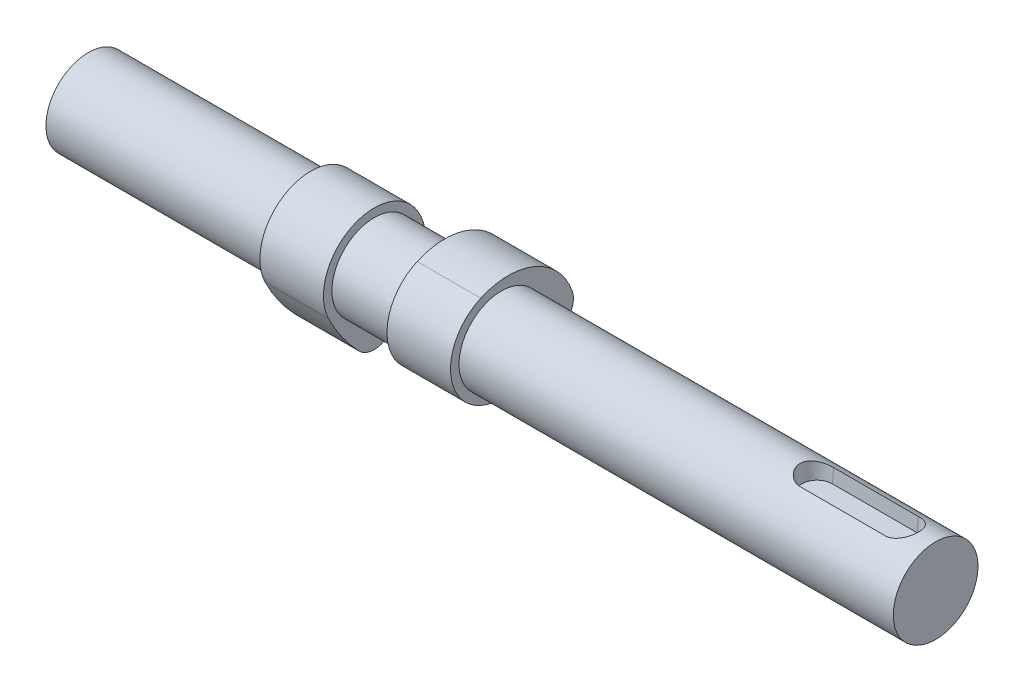
from build123d import *

# Parameters (mm, degrees)
BOSS_EXTRUDE1_DEPTH      = 125
BOSS_EXTRUDE1_DEPTH_BACK = 75
SKETCH2_R                = 10
BOSS_EXTRUDE2_START      = 15
BOSS_EXTRUDE2_DEPTH      = 7.5
BODY_MOVE_COPY1_ANGLE    = 90
CUT_EXTRUDE1_START       = 10
CUT_EXTRUDE1_DEPTH       = 4
CUT_EXTRUDE1_DRAFT       = -5


with BuildPart() as part:
    # Sketch2 → Boss-Extrude1 (new, two sides: drawn at the far end of the back side and taken through both)
    with BuildSketch(Plane(origin=(0, 0, 0), x_dir=(0, 0, -1), z_dir=(1, 0, 0)).offset(-BOSS_EXTRUDE1_DEPTH_BACK)):
        Circle(SKETCH2_R)
    extrude(amount=BOSS_EXTRUDE1_DEPTH + BOSS_EXTRUDE1_DEPTH_BACK)


with BuildPart() as body_2:
    # Sketch3 → Boss-Extrude2 (new, symmetric)
    with BuildSketch(Plane(origin=(0, 0, 0), x_dir=(0, 0, -1), z_dir=(1, 0, 0)).offset(BOSS_EXTRUDE2_START)):
        with BuildLine():
            ThreePointArc((-4.867089568, 10.968657125), (-10.868088345, -5.087696504), (5.306226617, -10.763083159))
            ThreePointArc((5.306226617, -10.763083159), (10.673744978, -7.573594418), (15.479542802, -3.587694386))
            ThreePointArc((15.479542802, -3.587694386), (16.864464688, -1.143374761), (16.712672037, 1.661917746))
            ThreePointArc((16.712672037, 1.661917746), (7.958571112, 11.035699457), (-4.867089568, 10.968657125))
        make_face()
    extrude(amount=BOSS_EXTRUDE2_DEPTH, both=True)


with BuildPart() as body_3:
    # Mirror1: mirrored copy
    add(body_2.part.mirror(Plane(origin=(0, 0, 0), x_dir=(0, 0, 1), z_dir=(1, 0, 0))))


with BuildPart() as body_3_1:
    # Body-Move/Copy1: moved
    add(body_3.part.rotate(Axis((0, 0, 0), (-1, 0, 0)), BODY_MOVE_COPY1_ANGLE))


with BuildPart() as cut_extrude1_tool:
    # Sketch4 → Cut-Extrude1 (with draft: the straight prism first)
    with BuildSketch(Plane(origin=(0, 0, 0), x_dir=(1, 0, 0), z_dir=(0, 1, 0)).offset(CUT_EXTRUDE1_START)):
        with BuildLine():
            ThreePointArc((97, 4), (93, 0), (97, -4))
            Line((97, -4), (117, -4))
            ThreePointArc((117, -4), (121, 0), (117, 4))
            Line((117, 4), (97, 4))
        make_face()
    extrude(amount=-CUT_EXTRUDE1_DEPTH)
    # Cut-Extrude1: the draft: its side faces are tilted about the plane it starts from
    cut_extrude1_sides = [cut_extrude1_tool.faces().sort_by_distance(p)[0] for p in [
        (93, 8, 0),
        (107, 8, 4),
        (121, 8, 0),
        (107, 8, -4),
    ]]
    draft(cut_extrude1_sides, Plane(origin=(0, 0, 0), x_dir=(1, 0, 0), z_dir=(0, 1, 0)).offset(CUT_EXTRUDE1_START), CUT_EXTRUDE1_DRAFT)


with BuildPart() as part_1:
    add(part.part)

    # Cut-Extrude1: cut by cut_extrude1_tool
    add(cut_extrude1_tool.part, mode=Mode.SUBTRACT)


solid = Compound([body_2.part, body_3_1.part, part_1.part])
